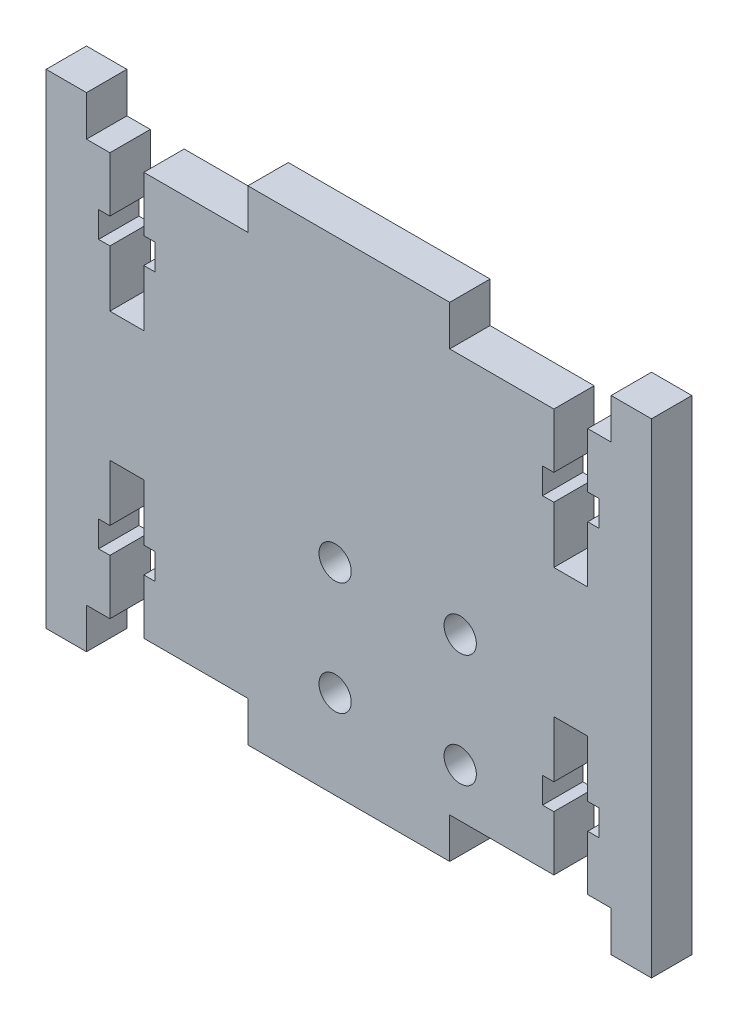
from build123d import *

# Parameters (mm, degrees)
BOSS_EXTRUDE1_DEPTH = 5
SKETCH2_R           = 2
CUT_EXTRUDE2_DEPTH  = 5


with BuildPart() as part:
    # Sketch1 → Boss-Extrude1 (new body)
    with BuildSketch(Plane.XY):
        Polygon((2.9, 50), (0, 50), (0, 55), (-5, 55), (-5, -5), (0, -5), (0, 0), (2.9, 0), (2.9, 6.8), (1.5, 6.8), (1.5, 10), (2.9, 10), (2.9, 17), (7.1, 17), (7.1, 10), (8.5, 10), (8.5, 6.8), (7.1, 6.8), (7.1, 0), (20, 0), (20, -5), (45, -5), (45, 0), (57.9, 0), (57.9, 6.8), (56.5, 6.8), (56.5, 10), (57.9, 10), (57.9, 17), (62.1, 17), (62.1, 10), (63.5, 10), (63.5, 6.8), (62.1, 6.8), (62.1, 0), (65, 0), (65, -5), (70, -5), (70, 55), (65, 55), (65, 50), (62.1, 50), (62.1, 43.2), (63.5, 43.2), (63.5, 40), (62.1, 40), (62.1, 33), (57.9, 33), (57.9, 40), (56.5, 40), (56.5, 43.2), (57.9, 43.2), (57.9, 50), (45, 50), (45, 55), (20, 55), (20, 50), (7.1, 50), (7.1, 43.2), (8.5, 43.2), (8.5, 40), (7.1, 40), (7.1, 33), (2.9, 33), (2.9, 40), (1.5, 40), (1.5, 43.2), (2.9, 43.2), align=None)
    extrude(amount=BOSS_EXTRUDE1_DEPTH)

    # Sketch2 → Cut-Extrude2 (cut)
    with BuildSketch(Plane(origin=(0, 0, 0), x_dir=(-1, 0, 0), z_dir=(0, 0, -1))):
        with Locations((-46.3, 20)):
            Circle(SKETCH2_R)
        with Locations((-46.3, 6)):
            Circle(SKETCH2_R)
        with Locations((-30.8, 6)):
            Circle(SKETCH2_R)
        with Locations((-30.8, 20)):
            Circle(SKETCH2_R)
    extrude(amount=-CUT_EXTRUDE2_DEPTH, mode=Mode.SUBTRACT)


solid = part.part
